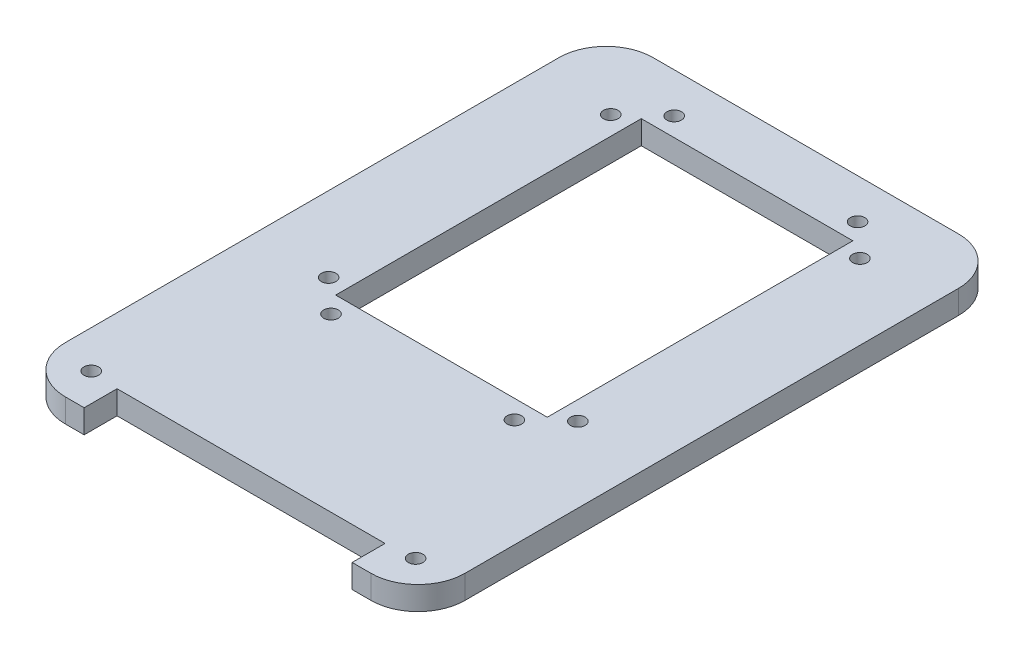
from build123d import *

# Parameters (mm, degrees)
SKETCH1_W             = 85
SKETCH1_H             = 160
BOSS_EXTRUDE1_DEPTH   = 5
SKETCH2_W             = 45
SKETCH2_H             = 65
CUT_EXTRUDE1_DEPTH    = 91.726236558
SKETCH8_W             = 57
SKETCH8_H             = 14
CUT_EXTRUDE2_DEPTH    = 91.726236558
F_2_0MM_DOWEL_HOLE1_D = 3.1
MIRROR9_COPY_1_D      = 3.1
F_2_0MM_DOWEL_HOLE3_D = 3.1
MIRROR11_COPY_1_D     = 3.1
F_2_5MM_DOWEL_HOLE4_D = 3.1
SKETCH39_W            = 85
SKETCH39_H            = 5
CUT_EXTRUDE3_DEPTH    = 35
FILLET1_R             = 10
SKETCH41_W            = 47
SKETCH41_H            = 15
SKETCH41_W_2          = 10
SKETCH41_H_2          = 45
BOSS_EXTRUDE3_DEPTH   = 4.5


with BuildPart() as part:
    # Sketch1 → Boss-Extrude1 (new body)
    with BuildSketch(Plane(origin=(0, 0, 0), x_dir=(1, 0, 0), z_dir=(0, 1, 0))):
        Rectangle(SKETCH1_W, SKETCH1_H)
    extrude(amount=BOSS_EXTRUDE1_DEPTH)

    # Sketch2 → Cut-Extrude1 (cut, through all)
    with BuildSketch(Plane(origin=(0, 5, 0), x_dir=(1, 0, 0), z_dir=(0, 1, 0))):
        Rectangle(SKETCH2_W, SKETCH2_H)
    extrude(amount=-CUT_EXTRUDE1_DEPTH, mode=Mode.SUBTRACT)

    # Sketch8 → Cut-Extrude2 (cut, through all)
    with BuildSketch(Plane(origin=(0, 5, 0), x_dir=(1, 0, 0), z_dir=(0, 1, 0))):
        with Locations((0, -80)):
            Rectangle(SKETCH8_W, SKETCH8_H)
    extrude(amount=-CUT_EXTRUDE2_DEPTH, mode=Mode.SUBTRACT)

    # Ø2.0mm Dowel Hole1 (through all)
    with Locations(Plane(origin=(26.5, 5, -30), x_dir=(0, 0, 1), z_dir=(0, 1, 0))):
        with Locations((0, 0)):
            f_2_0mm_dowel_hole1 = Hole(F_2_0MM_DOWEL_HOLE1_D / 2)

    # Mirror8: Ø2.0mm Dowel Hole1 across plane
    add(f_2_0mm_dowel_hole1.mirror(Plane(origin=(0, 0, 0), x_dir=(0, 0, 1), z_dir=(1, 0, 0))), mode=Mode.SUBTRACT)

    # Mirror9: Ø2.0mm Dowel Hole1 across plane
    add(f_2_0mm_dowel_hole1.mirror(Plane.XY), mode=Mode.SUBTRACT)

    # Mirror9 copy 1 (through all)
    with Locations(Plane(origin=(-26.5, 5, 30), x_dir=(0, 0, -1), z_dir=(0, 1, 0))):
        with Locations((0, 0)):
            Hole(MIRROR9_COPY_1_D / 2)

    # Ø2.0mm Dowel Hole3 (through all)
    with Locations(Plane(origin=(19.5, 5, -36.5), x_dir=(0, 0, 1), z_dir=(0, 1, 0))):
        with Locations((0, 0)):
            f_2_0mm_dowel_hole3 = Hole(F_2_0MM_DOWEL_HOLE3_D / 2)

    # Mirror10: Ø2.0mm Dowel Hole3 across plane
    add(f_2_0mm_dowel_hole3.mirror(Plane(origin=(0, 0, 0), x_dir=(0, 0, 1), z_dir=(1, 0, 0))), mode=Mode.SUBTRACT)

    # Mirror11: Ø2.0mm Dowel Hole3 across plane
    add(f_2_0mm_dowel_hole3.mirror(Plane.XY), mode=Mode.SUBTRACT)

    # Mirror11 copy 1 (through all)
    with Locations(Plane(origin=(-19.5, 5, 36.5), x_dir=(0, 0, -1), z_dir=(0, 1, 0))):
        with Locations((0, 0)):
            Hole(MIRROR11_COPY_1_D / 2)

    # Ø2.5mm Dowel Hole4 (through all)
    with Locations(Plane(origin=(34.5, 5, 72.5), x_dir=(0, 0, 1), z_dir=(0, 1, 0))):
        with Locations((0, 0)):
            f_2_5mm_dowel_hole4 = Hole(F_2_5MM_DOWEL_HOLE4_D / 2)

    # Mirror12: Ø2.5mm Dowel Hole4 across plane
    add(f_2_5mm_dowel_hole4.mirror(Plane(origin=(0, 0, 0), x_dir=(0, 0, 1), z_dir=(1, 0, 0))), mode=Mode.SUBTRACT)

    # Sketch39 → Cut-Extrude3 (cut)
    with BuildSketch(Plane(origin=(0, 0, -80), x_dir=(-1, 0, 0), z_dir=(0, 0, -1))):
        with Locations((0, 2.5)):
            Rectangle(SKETCH39_W, SKETCH39_H)
    extrude(amount=-CUT_EXTRUDE3_DEPTH, mode=Mode.SUBTRACT)

    # Fillet1
    fillet1_edges = [part.edges().sort_by_distance(p)[0] for p in [
        (-42.5, 2.5, -45),
        (42.5, 2.5, -45),
        (42.5, 2.5, 80),
        (-42.5, 2.5, 80),
    ]]
    fillet(fillet1_edges, radius=FILLET1_R)

    # Sketch41 → Boss-Extrude3 (add)
    with BuildSketch(Plane(origin=(0, 0, 0), x_dir=(-1, 0, 0), z_dir=(0, -1, 0))):
        with Locations((0, -55.5)):
            Rectangle(SKETCH41_W, SKETCH41_H)
        with Locations((32.5, 0)):
            Rectangle(SKETCH41_W_2, SKETCH41_H_2)
        with Locations((-32.5, 0)):
            Rectangle(SKETCH41_W_2, SKETCH41_H_2)
    extrude(amount=BOSS_EXTRUDE3_DEPTH)


solid = part.part
